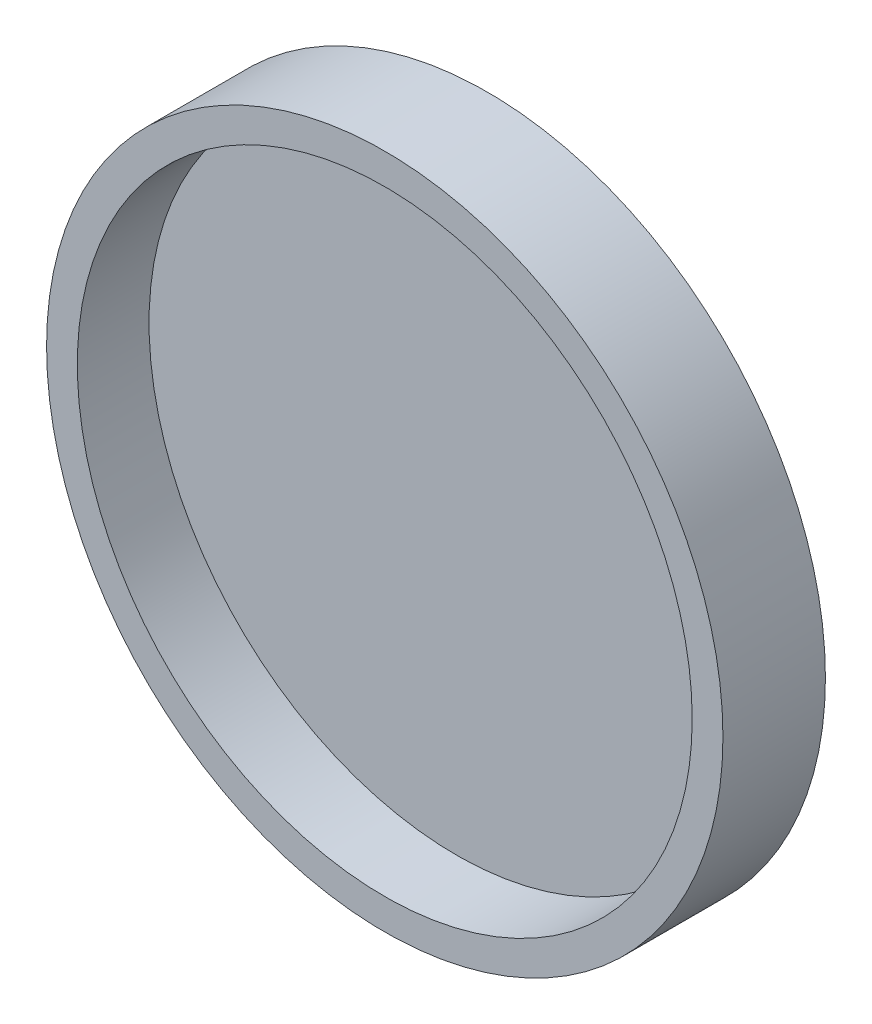
from build123d import *

# Parameters (mm, degrees)
SKETCH1_R           = 33
BOSS_EXTRUDE1_DEPTH = 10
SHELL1_T            = -3


with BuildPart() as part:
    # Sketch1 → Boss-Extrude1 (new body)
    with BuildSketch(Plane.XY):
        Circle(SKETCH1_R)
    extrude(amount=BOSS_EXTRUDE1_DEPTH)

    # Shell1
    shell1_openings = [part.faces().sort_by_distance(p)[0] for p in [
        (0, 0, 10),
    ]]
    offset(amount=SHELL1_T, openings=shell1_openings, kind=Kind.INTERSECTION)


solid = part.part
